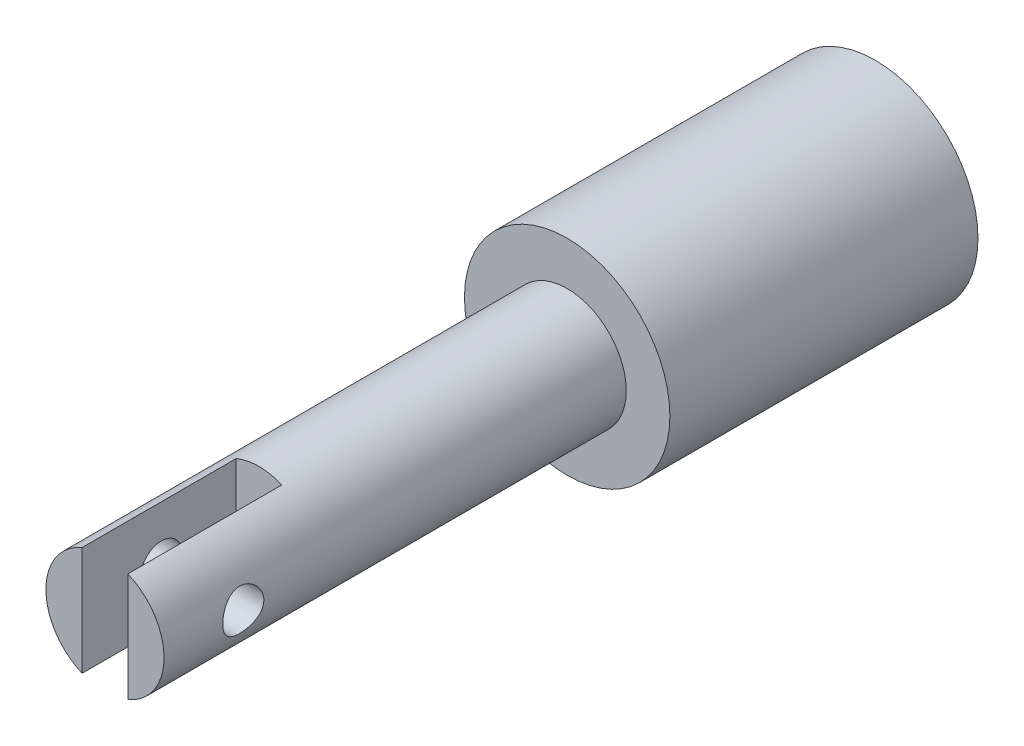
from build123d import *
from build123d.topology import SkipClean

# Parameters (mm, degrees)
ESQUISSE1_R                  = 10
BOSS_EXTRU_1_DEPTH           = 30
ESQUISSE2_R                  = 5.752589483
BOSS_EXTRU_2_DEPTH           = 30
BOSS_EXTRU_3_DEPTH           = 15
ENL_V_MAT_EXTRU_1_DEPTH      = 77.645000637
ENL_V_MAT_EXTRU_1_DEPTH_BACK = 77.645000637
ESQUISSE4_R                  = 2


with BuildPart() as part:
    # Esquisse1 → Boss.-Extru.1 (new body)
    with BuildSketch(Plane.XY):
        Circle(ESQUISSE1_R)
    extrude(amount=BOSS_EXTRU_1_DEPTH)

    # Esquisse2 → Boss.-Extru.2 (add)
    with BuildSketch(Plane.XY.offset(30)):
        Circle(ESQUISSE2_R)
    extrude(amount=BOSS_EXTRU_2_DEPTH)

    # Esquisse3 → Boss.-Extru.3 (add)
    with SkipClean():  # the faces are left unmerged after this step: merging them gives an invalid solid
        with BuildSketch(Plane.XY.offset(60)):
            with BuildLine():
                Line((-2.225224852, 5.304777104), (-2.225224852, -5.304777104))
                ThreePointArc((-2.225224852, -5.304777104), (-5.752589483, 0), (-2.225224852, 5.304777104))
            make_face()
            with BuildLine():
                Line((2.225224852, 5.304777104), (2.225224852, -5.304777104))
                ThreePointArc((2.225224852, -5.304777104), (5.752589483, 0), (2.225224852, 5.304777104))
            make_face()
        extrude(amount=BOSS_EXTRU_3_DEPTH)

    # Esquisse4 → Enlèv. mat.-Extru.1 (cut, two sides: drawn at the far end of the back side and taken through both)
    with SkipClean():  # the faces are left unmerged after this step: merging them gives an invalid solid
        with BuildSketch(Plane.ZY.offset(-2.225224852).offset(-ENL_V_MAT_EXTRU_1_DEPTH_BACK)):
            with Locations((67.284392663, 0)):
                Circle(ESQUISSE4_R)
        extrude(amount=ENL_V_MAT_EXTRU_1_DEPTH + ENL_V_MAT_EXTRU_1_DEPTH_BACK, mode=Mode.SUBTRACT)


solid = part.part
